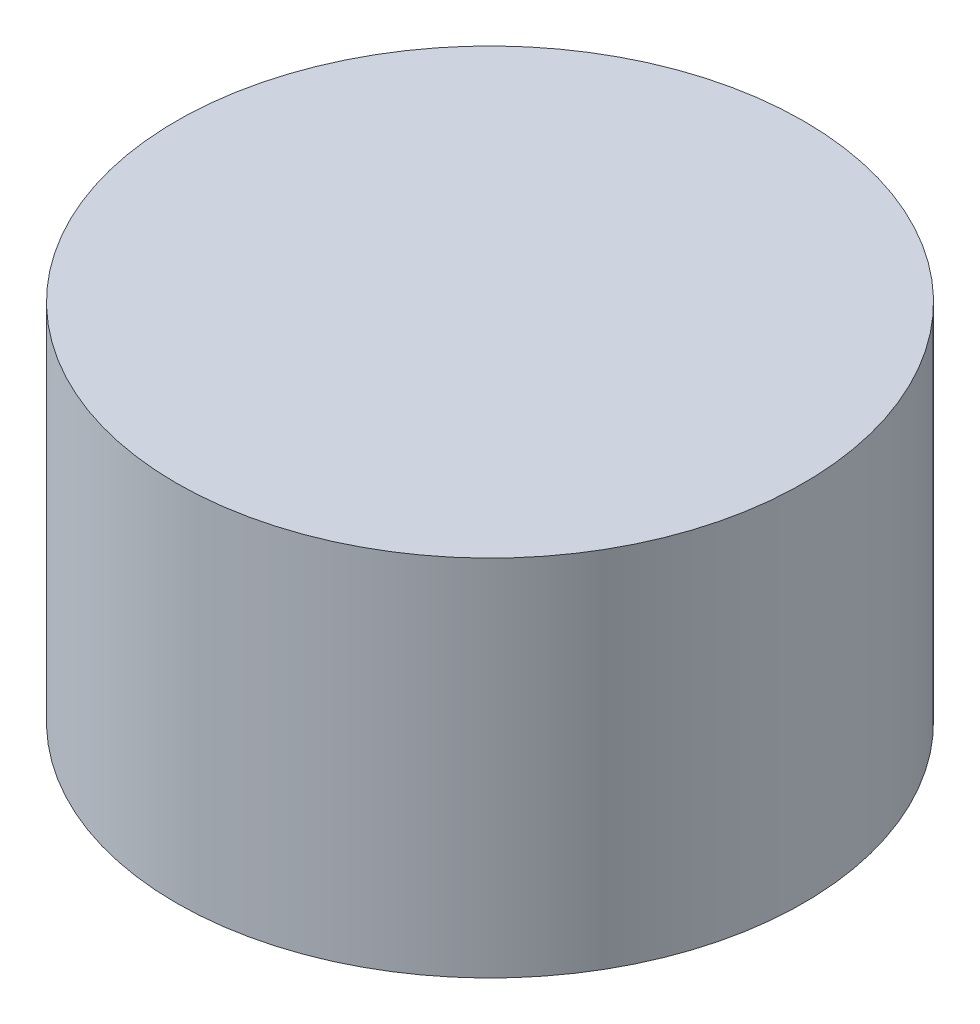
from build123d import *

# Parameters (mm, degrees)
SKETCH1_R           = 17.25
BOSS_EXTRUDE1_DEPTH = 20


with BuildPart() as part:
    # Sketch1 → Boss-Extrude1 (new body)
    with BuildSketch(Plane(origin=(0, 0, 0), x_dir=(1, 0, 0), z_dir=(0, 1, 0))):
        Circle(SKETCH1_R)
    extrude(amount=BOSS_EXTRUDE1_DEPTH)


solid = part.part
